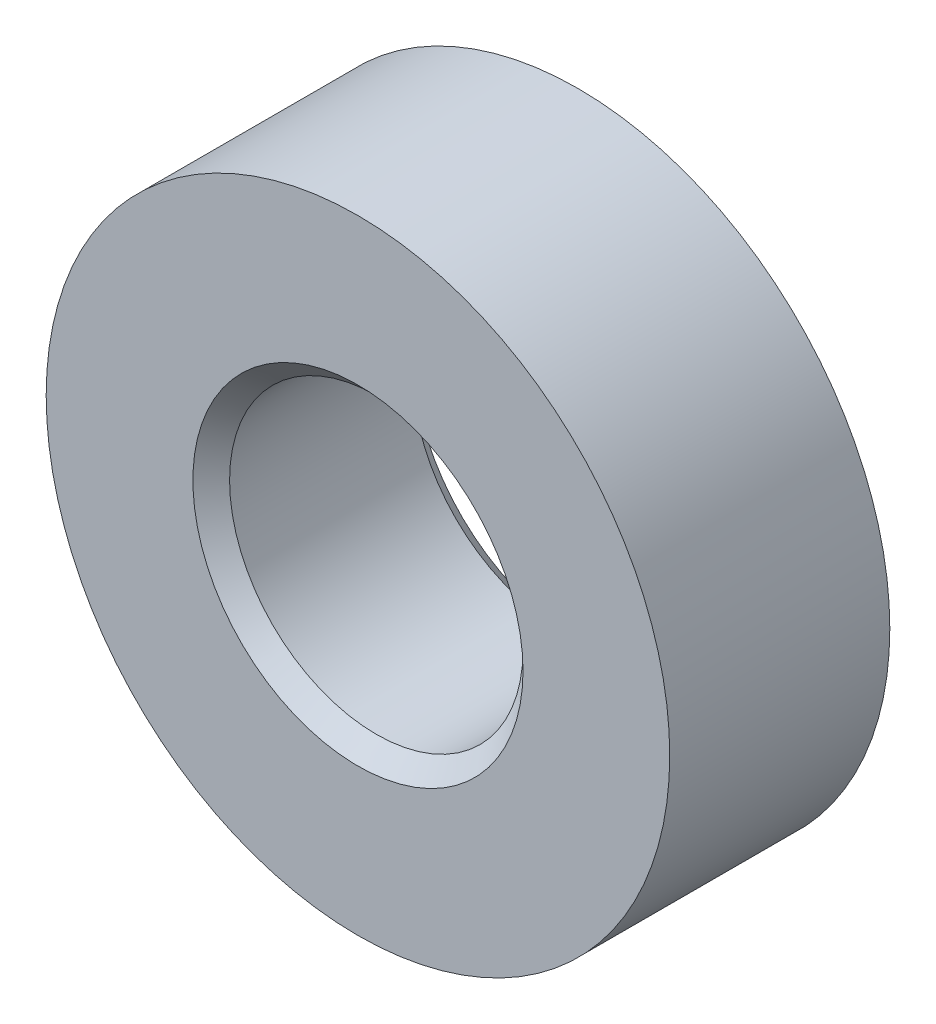
from build123d import *

# Parameters (mm, degrees)
SKETCH1_R           = 8.5
SKETCH1_R_2         = 4
BOSS_EXTRUDE1_DEPTH = 6
CHAMFER1_SIZE       = 0.5


with BuildPart() as part:
    # Sketch1 → Boss-Extrude1 (new body)
    with BuildSketch(Plane.XY):
        Circle(SKETCH1_R)
        Circle(SKETCH1_R_2, mode=Mode.SUBTRACT)
    extrude(amount=BOSS_EXTRUDE1_DEPTH)

    # Chamfer1
    chamfer1_edges = [part.edges().sort_by_distance(p)[0] for p in [
        (-4, 0, 0),
        (-4, 0, 6),
    ]]
    chamfer(chamfer1_edges, length=CHAMFER1_SIZE)


solid = part.part
